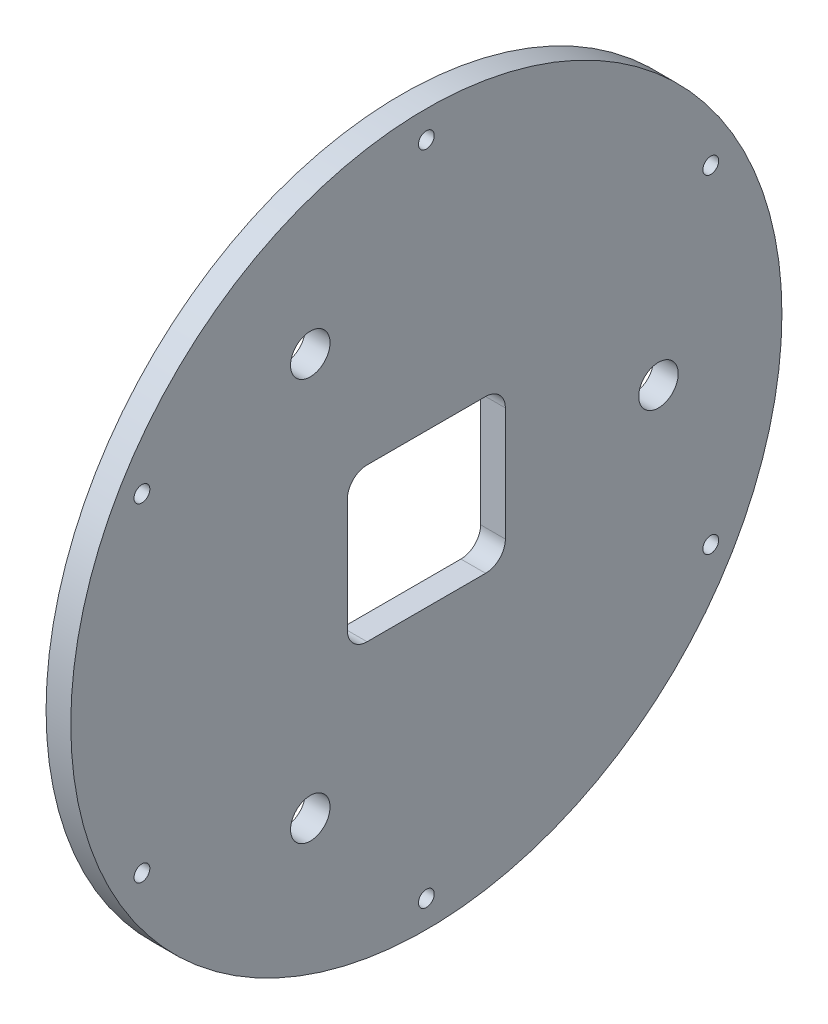
from build123d import *

# Parameters (mm, degrees)
SKETCH4_R           = 72
BOSS_EXTRUDE3_DEPTH = 5
SKETCH3_R           = 4
CUT_EXTRUDE6_DEPTH  = 102.946064171
SKETCH2_R           = 1.6
CUT_EXTRUDE1_DEPTH  = 102.946064171
GOPRO_DEPTH         = 102.946064171


with BuildPart() as part:
    # Sketch4 → Boss-Extrude3 (new body)
    with BuildSketch(Plane(origin=(0, 0, 0), x_dir=(0, 0, -1), z_dir=(1, 0, 0))):
        Circle(SKETCH4_R)
    extrude(amount=BOSS_EXTRUDE3_DEPTH)

    # Sketch3 → Cut-Extrude6 (cut, through all)
    with BuildSketch(Plane(origin=(0, 0, 0), x_dir=(0, 0, -1), z_dir=(1, 0, 0))):
        with Locations((47, 0)):
            Circle(SKETCH3_R)
        with Locations((-23.5, -40.703193978)):
            Circle(SKETCH3_R)
        with Locations((-23.5, 40.703193978)):
            Circle(SKETCH3_R)
    extrude(amount=CUT_EXTRUDE6_DEPTH, mode=Mode.SUBTRACT)

    # Sketch2 → Cut-Extrude1 (cut, through all)
    with BuildSketch(Plane(origin=(0, 0, 0), x_dir=(0, 0, -1), z_dir=(1, 0, 0))):
        with Locations((0, 66.5)):
            Circle(SKETCH2_R)
        with Locations((57.590689352, 33.25)):
            Circle(SKETCH2_R)
        with Locations((57.590689352, -33.25)):
            Circle(SKETCH2_R)
        with Locations((0, -66.5)):
            Circle(SKETCH2_R)
        with Locations((-57.590689352, -33.25)):
            Circle(SKETCH2_R)
        with Locations((-57.590689352, 33.25)):
            Circle(SKETCH2_R)
    extrude(amount=CUT_EXTRUDE1_DEPTH, mode=Mode.SUBTRACT)

    # Sketch1 → gopro (cut, through all)
    with BuildSketch(Plane(origin=(0, 0, 0), x_dir=(0, 0, -1), z_dir=(1, 0, 0))):
        with BuildLine():
            Line((-12, 15.5), (12, 15.5))
            ThreePointArc((12, 15.5), (14.828427125, 14.328427125), (16, 11.5))
            Line((16, 11.5), (16, -11.5))
            ThreePointArc((16, -11.5), (14.828427125, -14.328427125), (12, -15.5))
            Line((12, -15.5), (-12, -15.5))
            ThreePointArc((-12, -15.5), (-14.828427125, -14.328427125), (-16, -11.5))
            Line((-16, -11.5), (-16, 11.5))
            ThreePointArc((-16, 11.5), (-14.828427125, 14.328427125), (-12, 15.5))
        make_face()
    extrude(amount=GOPRO_DEPTH, mode=Mode.SUBTRACT)


solid = part.part
